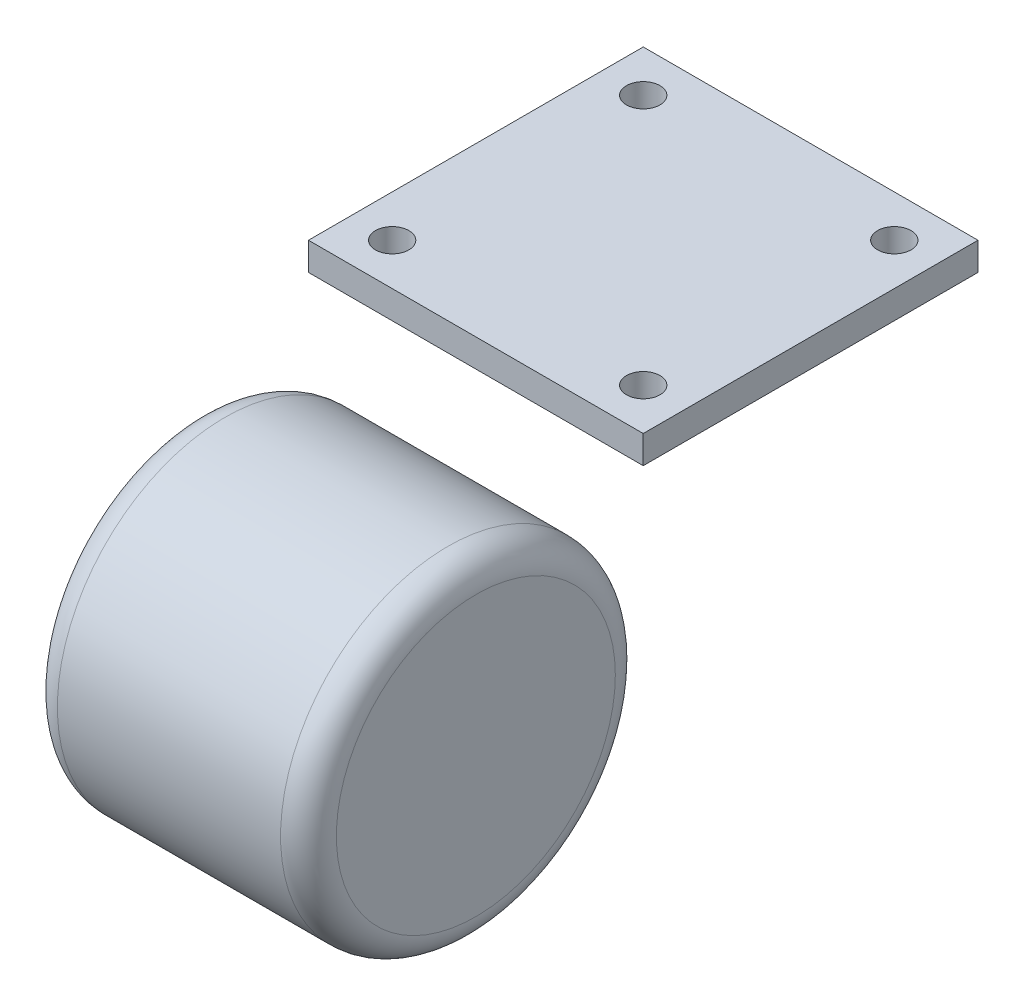
from build123d import *

# Parameters (mm, degrees)
SKETCH1_W           = 60
SKETCH1_H           = 60
SKETCH1_R           = 3
BOSS_EXTRUDE1_DEPTH = 5
SKETCH2_R           = 30
BOSS_EXTRUDE2_DEPTH = 25
FILLET1_R           = 5


with BuildPart() as part:
    # Sketch1 → Boss-Extrude1 (new body)
    with BuildSketch(Plane(origin=(0, 0, 0), x_dir=(1, 0, 0), z_dir=(0, 1, 0))):
        Rectangle(SKETCH1_W, SKETCH1_H)
        with Locations((22.5, 22.5)):
            Circle(SKETCH1_R, mode=Mode.SUBTRACT)
        with Locations((-22.5, 22.5)):
            Circle(SKETCH1_R, mode=Mode.SUBTRACT)
        with Locations((22.5, -22.5)):
            Circle(SKETCH1_R, mode=Mode.SUBTRACT)
        with Locations((-22.5, -22.5)):
            Circle(SKETCH1_R, mode=Mode.SUBTRACT)
    extrude(amount=BOSS_EXTRUDE1_DEPTH)


with BuildPart() as body_2:
    # Sketch2 → Boss-Extrude2 (new, symmetric)
    with BuildSketch(Plane(origin=(0, 0, 0), x_dir=(0, 0, -1), z_dir=(1, 0, 0))):
        with Locations((-55, -35)):
            Circle(SKETCH2_R)
    extrude(amount=BOSS_EXTRUDE2_DEPTH, both=True)

    # Fillet1
    fillet1_edges = [body_2.edges().sort_by_distance(p)[0] for p in [
        (-25, -35, 85),
        (25, -35, 85),
    ]]
    fillet(fillet1_edges, radius=FILLET1_R)


solid = Compound([part.part, body_2.part])
